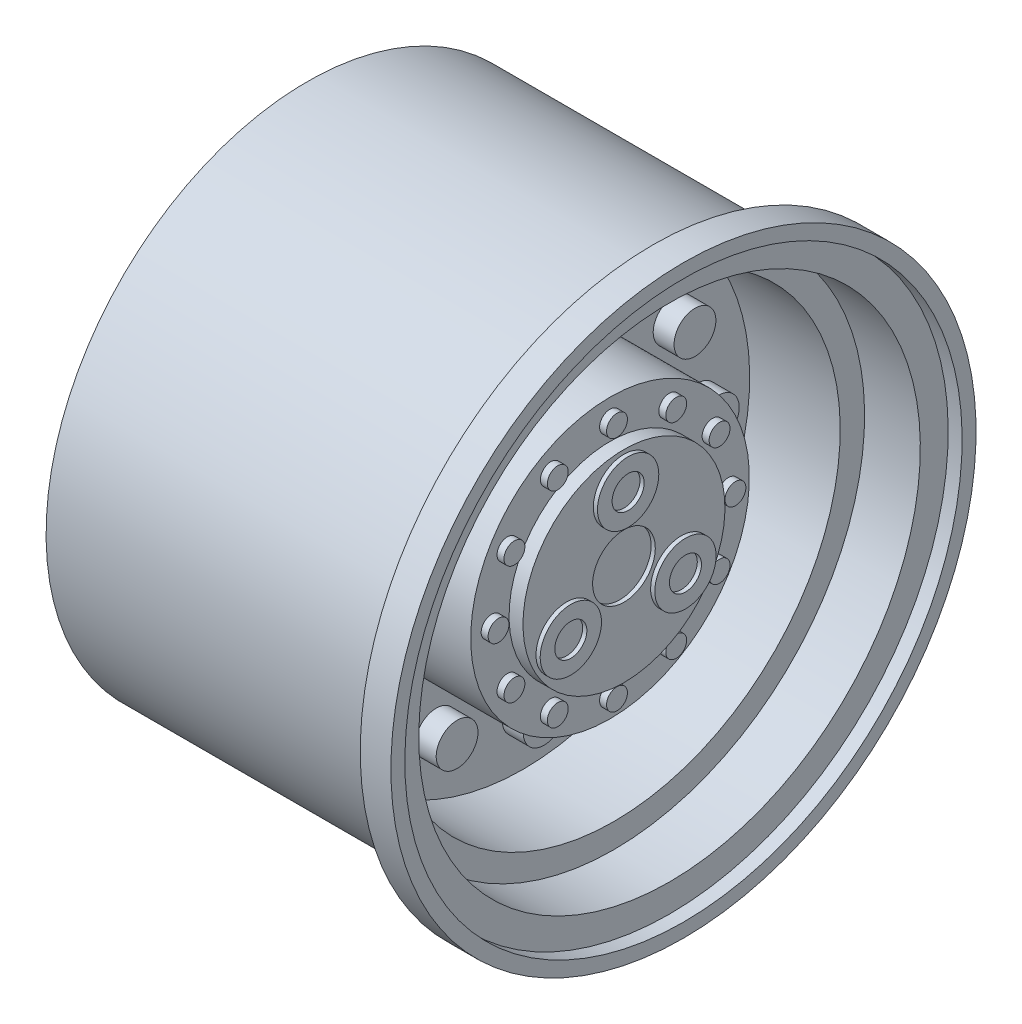
from build123d import *

# Parameters (mm, degrees)
SKETCH2_R           = 0.75
BOSS_EXTRUDE1_DEPTH = 0.75
SKETCH3_R           = 0.375
BOSS_EXTRUDE2_DEPTH = 0.25
SKETCH4_R           = 1.125
CUT_EXTRUDE1_DEPTH  = 0.15
SKETCH5_R           = 1.1
SKETCH5_R_2         = 0.575
BOSS_EXTRUDE3_DEPTH = 0.15
SKETCH6_R           = 0.375
BOSS_EXTRUDE4_DEPTH = 0.25
SKETCH7_R           = 1.25
CUT_EXTRUDE2_DEPTH  = 5


with BuildPart() as part:
    # Sketch1 → Revolve1 (revolve)
    with BuildSketch(Plane.XY):
        Polygon((0, 9.375), (-6.807, 9.375), (-6.807, 8.5), (-5.307, 8.5), (-5.307, 8.125), (-2.907, 8.125), (-2.907, 4.5), (-3.807, 4.5), (-3.807, 3.25), (-4.557, 3.25), (-4.557, 0), (4.557, 0), (4.557, 3.625), (4.057, 3.625), (4.057, 5), (0.943, 5), (0.943, 8.125), (4.193, 8.125), (4.193, 9), (6.193, 9), (6.193, 10), (6.693, 10), (6.693, 10.5), (5.593, 10.5), (5.593, 9.375), align=None)
    revolve(axis=Axis((-4.557, 0, 0), (1, 0, 0)))

    # Sketch2 → Boss-Extrude1 (add)
    with BuildSketch(Plane(origin=(0.943, 0, 0), x_dir=(0, 0, -1), z_dir=(1, 0, 0))):
        with Locations((0, 6.25)):
            Circle(SKETCH2_R)
        with Locations((3.125, 5.412658774)):
            Circle(SKETCH2_R)
        with Locations((5.412658774, 3.125)):
            Circle(SKETCH2_R)
        with Locations((6.25, 0)):
            Circle(SKETCH2_R)
        with Locations((5.412658774, -3.125)):
            Circle(SKETCH2_R)
        with Locations((3.125, -5.412658774)):
            Circle(SKETCH2_R)
        with Locations((0, -6.25)):
            Circle(SKETCH2_R)
        with Locations((-3.125, -5.412658774)):
            Circle(SKETCH2_R)
        with Locations((-5.412658774, -3.125)):
            Circle(SKETCH2_R)
        with Locations((-6.25, 0)):
            Circle(SKETCH2_R)
        with Locations((-5.412658774, 3.125)):
            Circle(SKETCH2_R)
        with Locations((-3.125, 5.412658774)):
            Circle(SKETCH2_R)
    extrude(amount=BOSS_EXTRUDE1_DEPTH)

    # Sketch3 → Boss-Extrude2 (add)
    with BuildSketch(Plane(origin=(4.057, 0, 0), x_dir=(0, 0, -1), z_dir=(1, 0, 0))):
        with Locations((0, 4.25)):
            Circle(SKETCH3_R)
        with Locations((2.125, 3.680607966)):
            Circle(SKETCH3_R)
        with Locations((3.680607966, 2.125)):
            Circle(SKETCH3_R)
        with Locations((4.25, 0)):
            Circle(SKETCH3_R)
        with Locations((3.680607966, -2.125)):
            Circle(SKETCH3_R)
        with Locations((2.125, -3.680607966)):
            Circle(SKETCH3_R)
        with Locations((0, -4.25)):
            Circle(SKETCH3_R)
        with Locations((-2.125, -3.680607966)):
            Circle(SKETCH3_R)
        with Locations((-3.680607966, -2.125)):
            Circle(SKETCH3_R)
        with Locations((-4.25, 0)):
            Circle(SKETCH3_R)
        with Locations((-3.680607966, 2.125)):
            Circle(SKETCH3_R)
        with Locations((-2.125, 3.680607966)):
            Circle(SKETCH3_R)
    extrude(amount=BOSS_EXTRUDE2_DEPTH)

    # Sketch4 → Cut-Extrude1 (cut)
    with BuildSketch(Plane(origin=(4.557, 0, 0), x_dir=(0, 0, -1), z_dir=(1, 0, 0))):
        Circle(SKETCH4_R)
    extrude(amount=-CUT_EXTRUDE1_DEPTH, mode=Mode.SUBTRACT)

    # Sketch5 → Boss-Extrude3 (add)
    # profile 1 of 3: a face of its own
    with BuildSketch(Plane(origin=(4.557, 0, 0), x_dir=(0, 0, -1), z_dir=(1, 0, 0))):
        with Locations((0, 2.375)):
            Circle(SKETCH5_R)
        with Locations((0, 2.375)):
            Circle(SKETCH5_R_2, mode=Mode.SUBTRACT)
    # profile 2 of 3: a face of its own
    with BuildSketch(Plane(origin=(4.557, 0, 0), x_dir=(0, 0, -1), z_dir=(1, 0, 0))):
        with Locations((2.056810334, -1.1875)):
            Circle(SKETCH5_R)
        with Locations((2.056810334, -1.1875)):
            Circle(SKETCH5_R_2, mode=Mode.SUBTRACT)
    # profile 3 of 3: a face of its own
    with BuildSketch(Plane(origin=(4.557, 0, 0), x_dir=(0, 0, -1), z_dir=(1, 0, 0))):
        with Locations((-2.056810334, -1.1875)):
            Circle(SKETCH5_R)
        with Locations((-2.056810334, -1.1875)):
            Circle(SKETCH5_R_2, mode=Mode.SUBTRACT)
    extrude(amount=BOSS_EXTRUDE3_DEPTH)

    # Sketch6 → Boss-Extrude4 (add)
    with BuildSketch(Plane.ZY.offset(3.807)):
        with Locations((0, 3.81)):
            Circle(SKETCH6_R)
        with Locations((1.905, 3.299556788)):
            Circle(SKETCH6_R)
        with Locations((3.299556788, 1.905)):
            Circle(SKETCH6_R)
        with Locations((3.81, 0)):
            Circle(SKETCH6_R)
        with Locations((3.299556788, -1.905)):
            Circle(SKETCH6_R)
        with Locations((1.905, -3.299556788)):
            Circle(SKETCH6_R)
        with Locations((0, -3.81)):
            Circle(SKETCH6_R)
        with Locations((-1.905, -3.299556788)):
            Circle(SKETCH6_R)
        with Locations((-3.299556788, -1.905)):
            Circle(SKETCH6_R)
        with Locations((-3.81, 0)):
            Circle(SKETCH6_R)
        with Locations((-3.299556788, 1.905)):
            Circle(SKETCH6_R)
        with Locations((-1.905, 3.299556788)):
            Circle(SKETCH6_R)
    extrude(amount=BOSS_EXTRUDE4_DEPTH)

    # Sketch7 → Cut-Extrude2 (cut)
    with BuildSketch(Plane.ZY.offset(4.557)):
        Circle(SKETCH7_R)
    extrude(amount=-CUT_EXTRUDE2_DEPTH, mode=Mode.SUBTRACT)


solid = part.part
